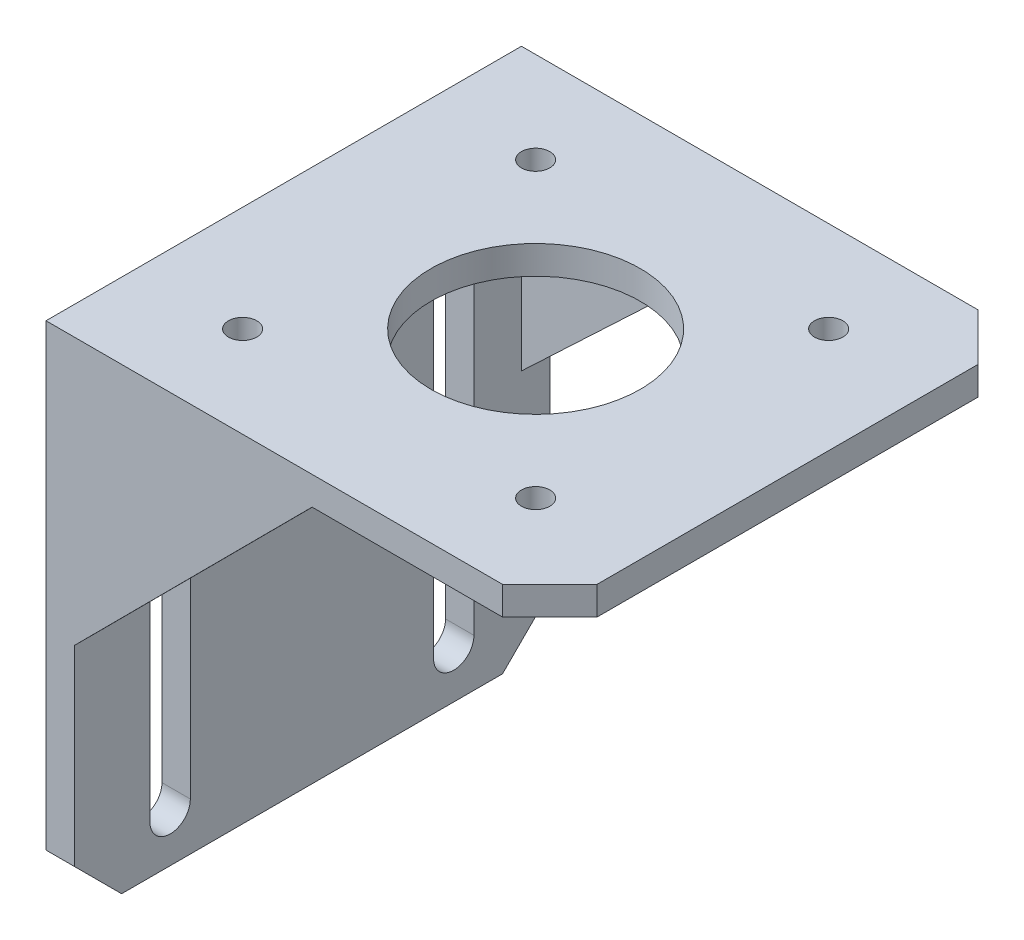
from build123d import *

# Parameters (mm, degrees)
SKETCH1_W           = 50.3
SKETCH1_H           = 53.5
BOSS_EXTRUDE1_DEPTH = 3
SKETCH3_W           = 50.3
SKETCH3_H           = 3
BOSS_EXTRUDE3_DEPTH = 50.3
BOSS_EXTRUDE6_DEPTH = 3
BOSS_EXTRUDE7_DEPTH = 3
SKETCH12_R          = 1.5
SKETCH12_R_2        = 11.075
CUT_EXTRUDE1_DEPTH  = 3
CHAMFER2_SIZE       = 5
CHAMFER3_SIZE       = 5
CHAMFER4_SIZE       = 5
CHAMFER5_SIZE       = 5


with BuildPart() as part:
    # Sketch1 → Boss-Extrude1 (new body)
    with BuildSketch(Plane(origin=(0, 0, 0), x_dir=(0, 0, -1), z_dir=(1, 0, 0))):
        with Locations((10.151141702, -3.113798218)):
            Rectangle(SKETCH1_W, SKETCH1_H)
        with BuildLine():
            Line((-6.998858298, -24.818417552), (-6.998858298, 18.3151534))
            ThreePointArc((-6.998858298, 18.3151534), (-4.863858298, 20.4501534), (-2.728858298, 18.3151534))
            Line((-2.728858298, 18.3151534), (-2.728858298, -24.818417552))
            ThreePointArc((-2.728858298, -24.818417552), (-4.863858298, -26.953417552), (-6.998858298, -24.818417552))
        make_face(mode=Mode.SUBTRACT)
        with BuildLine():
            Line((27.271141702, 18.3151534), (27.271141702, -24.818417552))
            ThreePointArc((27.271141702, -24.818417552), (25.136141702, -26.953417552), (23.001141702, -24.818417552))
            Line((23.001141702, -24.818417552), (23.001141702, 18.3151534))
            ThreePointArc((23.001141702, 18.3151534), (25.136141702, 20.4501534), (27.271141702, 18.3151534))
        make_face(mode=Mode.SUBTRACT)
    extrude(amount=BOSS_EXTRUDE1_DEPTH)

    # Sketch3 → Boss-Extrude3 (add)
    with BuildSketch(Plane(origin=(3, 0, 0), x_dir=(0, 0, -1), z_dir=(1, 0, 0))):
        with Locations((10.151141702, 22.136201782)):
            Rectangle(SKETCH3_W, SKETCH3_H)
    extrude(amount=BOSS_EXTRUDE3_DEPTH)

    # Sketch11 → Boss-Extrude6 (add)
    with BuildSketch(Plane.XY.offset(14.998858298)):
        Polygon((3, 20.636201782), (3, -4.613798218), (28.15, 20.636201782), align=None)
    extrude(amount=-BOSS_EXTRUDE6_DEPTH)

    # Sketch7 → Boss-Extrude7 (add)
    with BuildSketch(Plane(origin=(0, 0, -35.301141702), x_dir=(-1, 0, 0), z_dir=(0, 0, -1))):
        Polygon((-3, 20.636201782), (-28.15, 20.636201782), (-3, -3.113798218), align=None)
    extrude(amount=-BOSS_EXTRUDE7_DEPTH)

    # Sketch12 → Cut-Extrude1 (cut)
    with BuildSketch(Plane(origin=(0, 23.636201782, 0), x_dir=(1, 0, 0), z_dir=(0, 1, 0))):
        with Locations(Location((42.15, 25.651141702, 0), (0, 0, 270))):
            Circle(SKETCH12_R)
        with Locations(Location((42.15, -5.348858298, 0), (0, 0, 270))):
            Circle(SKETCH12_R)
        with Locations(Location((11.15, 25.651141702, 0), (0, 0, 270))):
            Circle(SKETCH12_R)
        with Locations(Location((11.15, -5.348858298, 0), (0, 0, 270))):
            Circle(SKETCH12_R)
        with Locations(Location((26.65, 10.151141702, 0), (0, 0, 270))):
            Circle(SKETCH12_R_2)
    extrude(amount=-CUT_EXTRUDE1_DEPTH, mode=Mode.SUBTRACT)

    # Chamfer2
    chamfer2_edges = [part.edges().sort_by_distance(p)[0] for p in [
        (53.3, 22.136201782, -35.301141702),
    ]]
    chamfer(chamfer2_edges, length=CHAMFER2_SIZE)

    # Chamfer3
    chamfer3_edges = [part.edges().sort_by_distance(p)[0] for p in [
        (53.3, 22.136201782, 14.998858298),
    ]]
    chamfer(chamfer3_edges, length=CHAMFER3_SIZE)

    # Chamfer4
    chamfer4_edges = [part.edges().sort_by_distance(p)[0] for p in [
        (1.5, -29.863798218, 14.998858298),
    ]]
    chamfer(chamfer4_edges, length=CHAMFER4_SIZE)

    # Chamfer5
    chamfer5_edges = [part.edges().sort_by_distance(p)[0] for p in [
        (1.5, -29.863798218, -35.301141702),
    ]]
    chamfer(chamfer5_edges, length=CHAMFER5_SIZE)


solid = part.part
